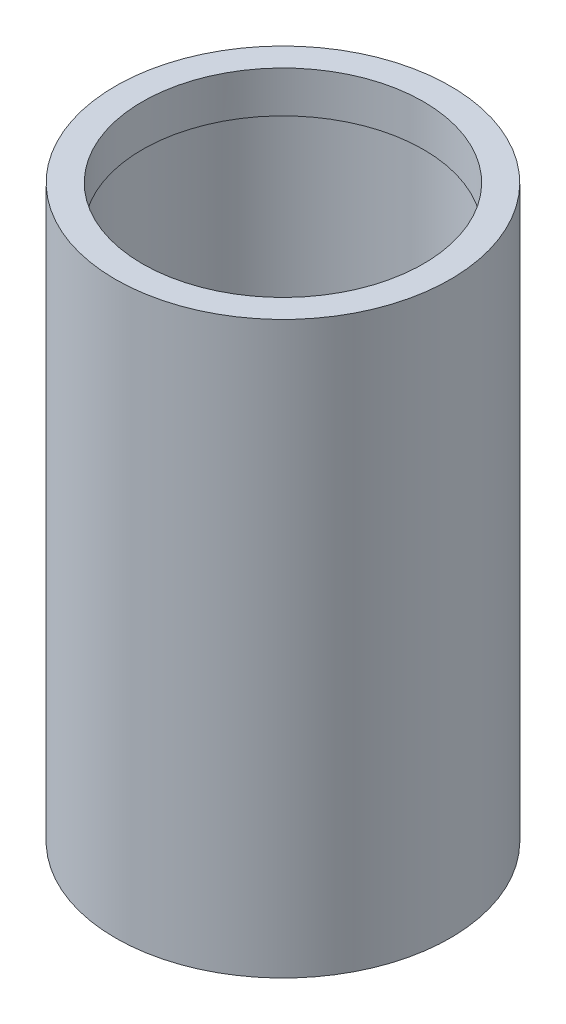
from build123d import *

# Parameters (mm, degrees)
SKETCH1_R           = 5.1308
BOSS_EXTRUDE1_DEPTH = 17.4752
SKETCH2_R           = 4.3053
CUT_EXTRUDE1_DEPTH  = 25.0952
SKETCH3_R           = 4.36626
CUT_EXTRUDE2_DEPTH  = 16.2052


with BuildPart() as part:
    # Sketch1 → Boss-Extrude1 (new body)
    with BuildSketch(Plane(origin=(0, 0, 0), x_dir=(1, 0, 0), z_dir=(0, 1, 0))):
        with Locations(Location((0, 0, 0), (0, 0, 270))):
            Circle(SKETCH1_R)
    extrude(amount=BOSS_EXTRUDE1_DEPTH)

    # Sketch2 → Cut-Extrude1 (cut)
    with BuildSketch(Plane.XZ):
        with Locations(Location((0, 0, 0), (0, 0, 270))):
            Circle(SKETCH2_R)
    extrude(amount=-CUT_EXTRUDE1_DEPTH, mode=Mode.SUBTRACT)

    # Sketch3 → Cut-Extrude2 (cut)
    with BuildSketch(Plane.XZ):
        with Locations(Location((0, 0, 0), (0, 0, 270))):
            Circle(SKETCH3_R)
    extrude(amount=-CUT_EXTRUDE2_DEPTH, mode=Mode.SUBTRACT)


solid = part.part
